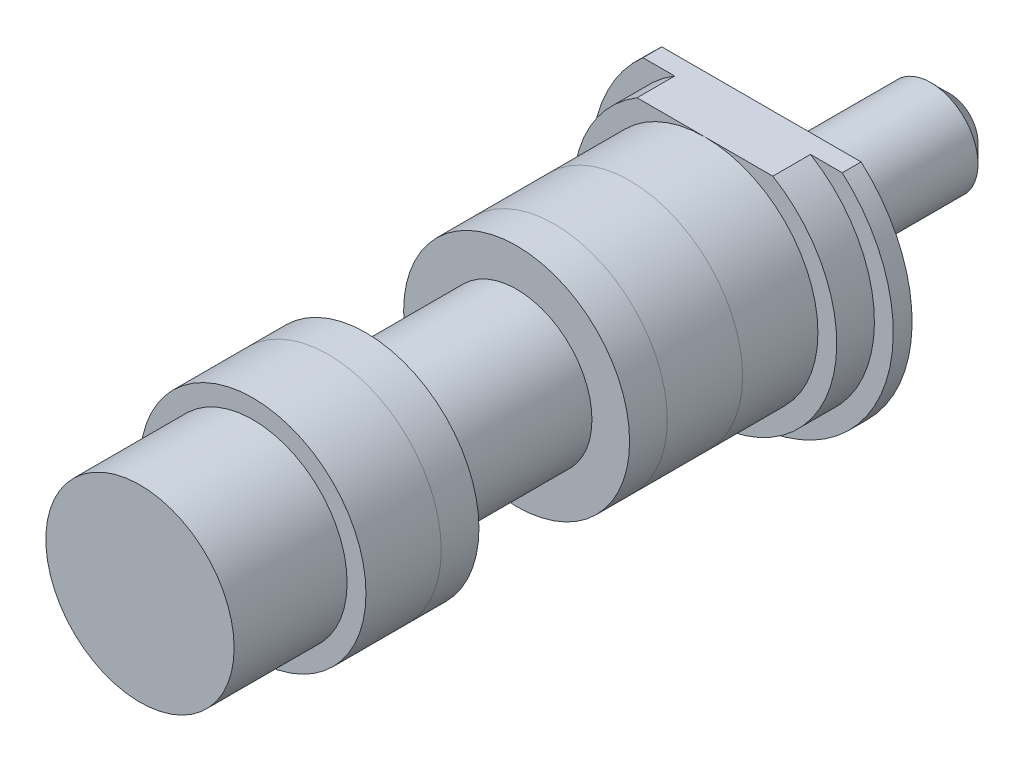
from build123d import *

# Parameters (mm, degrees)
SKETCH1_R            = 4
BOSS_EXTRUDE1_DEPTH  = 0.5
SKETCH2_R            = 3.5
BOSS_EXTRUDE2_DEPTH  = 1
SKETCH3_R            = 3
BOSS_EXTRUDE3_DEPTH  = 2
SKETCH4_R            = 2
BOSS_EXTRUDE4_DEPTH  = 2
SKETCH5_R            = 3
BOSS_EXTRUDE5_DEPTH  = 1
SKETCH6_R            = 2
BOSS_EXTRUDE6_DEPTH  = 4
SKETCH7_R            = 3
BOSS_EXTRUDE7_DEPTH  = 1
SKETCH8_R            = 2
BOSS_EXTRUDE8_DEPTH  = 2
SKETCH9_R            = 2.5
BOSS_EXTRUDE9_DEPTH  = 3
SKETCH10_R           = 1.25
BOSS_EXTRUDE10_DEPTH = 5
CHAMFER1_SIZE        = 1
CHAMFER2_SIZE        = 0.5
SKETCH11_W           = 6.076310812
SKETCH11_H           = 1
CUT_EXTRUDE1_DEPTH   = 6
SKETCH12_R           = 0.5
CUT_EXTRUDE2_DEPTH   = 2
SKETCH13_R           = 0.5
CUT_EXTRUDE3_DEPTH   = 15
SKETCH17_W           = 2
SKETCH17_H           = 1
SKETCH18_W           = 2
SKETCH18_H           = 1


with BuildPart() as part:
    # Sketch1 → Boss-Extrude1 (new body)
    with BuildSketch(Plane.XY):
        Circle(SKETCH1_R)
    extrude(amount=BOSS_EXTRUDE1_DEPTH)

    # Sketch2 → Boss-Extrude2 (add)
    with BuildSketch(Plane.XY.offset(0.5)):
        Circle(SKETCH2_R)
    extrude(amount=BOSS_EXTRUDE2_DEPTH)

    # Sketch3 → Boss-Extrude3 (add)
    with BuildSketch(Plane.XY.offset(1.5)):
        Circle(SKETCH3_R)
    extrude(amount=BOSS_EXTRUDE3_DEPTH)

    # Sketch4 → Boss-Extrude4 (add)
    with BuildSketch(Plane.XY.offset(3.5)):
        Circle(SKETCH4_R)
    extrude(amount=BOSS_EXTRUDE4_DEPTH)

    # Sketch5 → Boss-Extrude5 (add)
    with BuildSketch(Plane.XY.offset(5.5)):
        Circle(SKETCH5_R)
    extrude(amount=BOSS_EXTRUDE5_DEPTH)

    # Sketch6 → Boss-Extrude6 (add)
    with BuildSketch(Plane.XY.offset(6.5)):
        Circle(SKETCH6_R)
    extrude(amount=BOSS_EXTRUDE6_DEPTH)

    # Sketch7 → Boss-Extrude7 (add)
    with BuildSketch(Plane.XY.offset(10.5)):
        Circle(SKETCH7_R)
    extrude(amount=BOSS_EXTRUDE7_DEPTH)

    # Sketch8 → Boss-Extrude8 (add)
    with BuildSketch(Plane.XY.offset(11.5)):
        Circle(SKETCH8_R)
    extrude(amount=BOSS_EXTRUDE8_DEPTH)

    # Sketch9 → Boss-Extrude9 (add)
    with BuildSketch(Plane.XY.offset(13.5)):
        Circle(SKETCH9_R)
    extrude(amount=BOSS_EXTRUDE9_DEPTH)

    # Sketch10 → Boss-Extrude10 (add)
    with BuildSketch(Plane(origin=(0, 0, 0), x_dir=(-1, 0, 0), z_dir=(0, 0, -1))):
        Circle(SKETCH10_R)
    extrude(amount=BOSS_EXTRUDE10_DEPTH)

    # Chamfer1
    chamfer1_edges = [part.edges().sort_by_distance(p)[0] for p in [
        (1.25, 0, 0),
    ]]
    chamfer(chamfer1_edges, length=CHAMFER1_SIZE)

    # Chamfer2
    chamfer2_edges = [part.edges().sort_by_distance(p)[0] for p in [
        (1.25, 0, -5),
    ]]
    chamfer(chamfer2_edges, length=CHAMFER2_SIZE)

    # Sketch11 → Cut-Extrude1 (cut)
    with BuildSketch(Plane.XY.offset(1.5)):
        with Locations((0, 3.5)):
            Rectangle(SKETCH11_W, SKETCH11_H)
    extrude(amount=-CUT_EXTRUDE1_DEPTH, mode=Mode.SUBTRACT)

    # Sketch12 → Cut-Extrude2 (cut)
    with BuildSketch(Plane(origin=(-2, 0, 0), x_dir=(0, 0, -1), z_dir=(1, 0, 0))):
        with Locations(Location((-8.5, 0, 0), (0, 0, 180))):
            Circle(SKETCH12_R)
    extrude(amount=CUT_EXTRUDE2_DEPTH, mode=Mode.SUBTRACT)

    # Sketch13 → Cut-Extrude3 (cut)
    with BuildSketch(Plane(origin=(0, 0, -5), x_dir=(-1, 0, 0), z_dir=(0, 0, -1))):
        Circle(SKETCH13_R)
    extrude(amount=-CUT_EXTRUDE3_DEPTH, mode=Mode.SUBTRACT)


with BuildPart() as body_2:
    # Sketch17 → Revolve1 (revolve)
    with BuildSketch(Plane(origin=(0, 0, 0), x_dir=(0, 0, -1), z_dir=(1, 0, 0))):
        with Locations((-4.5, 2.5)):
            Rectangle(SKETCH17_W, SKETCH17_H)
    revolve(axis=Axis((0, 0, -2.311701569), (0, 0, 1)))


with BuildPart() as body_3:
    # Sketch18 → Revolve2 (revolve)
    with BuildSketch(Plane(origin=(0, 0, 0), x_dir=(0, 0, -1), z_dir=(1, 0, 0)), mode=Mode.PRIVATE) as revolve2_sk:
        with Locations((-12.5, 2.5)):
            Rectangle(SKETCH18_W, SKETCH18_H)
    revolve(revolve2_sk.sketch.rotate(Axis((0, 0, -0.797349903), (0, 0, 1)), 90), axis=Axis((0, 0, -0.797349903), (0, 0, 1)))


solid = Compound([part.part, body_2.part, body_3.part])
